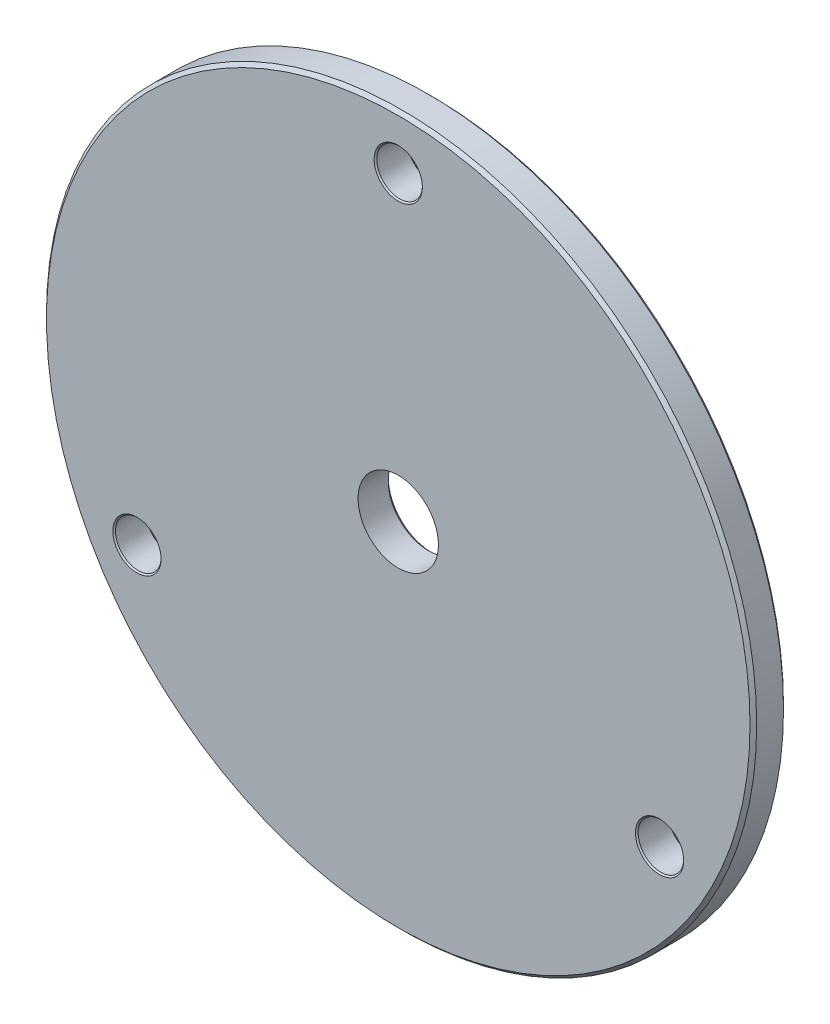
from build123d import *

# Parameters (mm, degrees)
ESQUISSE1_R                               = 53
BOSS_EXTRU_1_DEPTH                        = 5
CHANFREIN1_SIZE                           = 0.5
TROU_POUR_TARAUDAGE_POUR_TROU_TARAUD_M8_D = 6.8
CHANFREIN2_SIZE                           = 0.2
ESQUISSE4_R                               = 6
ENL_V_MAT_EXTRU_1_DEPTH                   = 76.119904153
CHANFREIN3_SIZE                           = 0.5


with BuildPart() as part:
    # Esquisse1 → Boss.-Extru.1 (new body)
    with BuildSketch(Plane.XY):
        Circle(ESQUISSE1_R)
    extrude(amount=BOSS_EXTRU_1_DEPTH)

    # Chanfrein1
    chanfrein1_edges = [part.edges().sort_by_distance(p)[0] for p in [
        (-53, 0, 0),
        (-53, 0, 5),
    ]]
    chamfer(chanfrein1_edges, length=CHANFREIN1_SIZE)

    # Trou pour taraudage pour trou taraudé M81 (through all)
    with Locations(Plane.XY.offset(5)):
        with Locations((0, 45.033320997), (39, -22.516660498), (-39, -22.516660498)):
            Hole(TROU_POUR_TARAUDAGE_POUR_TROU_TARAUD_M8_D / 2)

    # Chanfrein2
    chanfrein2_edges = [part.edges().sort_by_distance(p)[0] for p in [
        (42.4, -22.516660498, 5),
        (42.4, -22.516660498, 0),
        (-35.6, -22.516660498, 5),
        (-35.6, -22.516660498, 0),
        (3.4, 45.033320997, 5),
        (3.4, 45.033320997, 0),
    ]]
    chamfer(chanfrein2_edges, length=CHANFREIN2_SIZE)

    # Esquisse4 → Enlèv. mat.-Extru.1 (cut, through all)
    with BuildSketch(Plane.XY.offset(5)):
        Circle(ESQUISSE4_R)
    extrude(amount=-ENL_V_MAT_EXTRU_1_DEPTH, mode=Mode.SUBTRACT)

    # Chanfrein3
    chanfrein3_edges = [part.edges().sort_by_distance(p)[0] for p in [
        (-6, 0, 0),
    ]]
    chamfer(chanfrein3_edges, length=CHANFREIN3_SIZE)


solid = part.part
